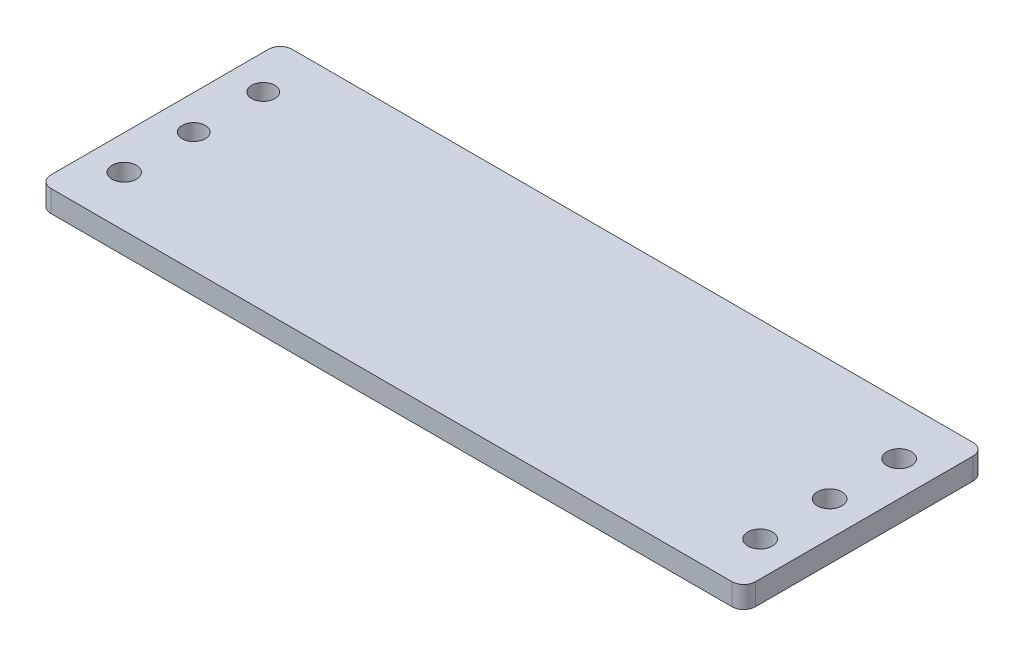
from build123d import *

# Parameters (mm, degrees)
SKETCH1_W           = 152.4
SKETCH1_H           = 52.832
BOSS_EXTRUDE1_DEPTH = 4.7625
SKETCH2_R           = 2.69
CUT_EXTRUDE1_DEPTH  = 81.789395729
SKETCH5_R           = 2.667
SKETCH5_R_2         = 2.54
CUT_EXTRUDE2_DEPTH  = 81.789395729
SKETCH6_W           = 52.832
SKETCH6_H           = 4.7625
BOSS_EXTRUDE2_DEPTH = 2
FILLET1_R           = 2.54


with BuildPart() as part:
    # Sketch1 → Boss-Extrude1 (new body)
    with BuildSketch(Plane(origin=(0, 0, 0), x_dir=(1, 0, 0), z_dir=(0, 1, 0))):
        Rectangle(SKETCH1_W, SKETCH1_H)
    extrude(amount=BOSS_EXTRUDE1_DEPTH)

    # Sketch2 → Cut-Extrude1 (cut, through all)
    with BuildSketch(Plane(origin=(0, 4.7625, 0), x_dir=(1, 0, 0), z_dir=(0, 1, 0))):
        with Locations(Location((68.607011479, -15.24, 0), (0, 0, 270))):
            Circle(SKETCH2_R)
        with Locations(Location((68.607011479, 0, 0), (0, 0, 270))):
            Circle(SKETCH2_R)
        with Locations(Location((68.607011479, 15.24, 0), (0, 0, 270))):
            Circle(SKETCH2_R)
    extrude(amount=-CUT_EXTRUDE1_DEPTH, mode=Mode.SUBTRACT)

    # Sketch5 → Cut-Extrude2 (cut, through all)
    with BuildSketch(Plane.XZ):
        with Locations(Location((-70.677366471, 15.3162, 0), (0, 0, 270))):
            Circle(SKETCH5_R)
        with Locations(Location((-70.677366471, 0.0762, 0), (0, 0, 270))):
            Circle(SKETCH5_R_2)
        with Locations(Location((-70.677366471, -15.1638, 0), (0, 0, 270))):
            Circle(SKETCH5_R_2)
    extrude(amount=-CUT_EXTRUDE2_DEPTH, mode=Mode.SUBTRACT)

    # Sketch6 → Boss-Extrude2 (add)
    with BuildSketch(Plane.ZY.offset(76.2)):
        with Locations((0, 2.38125)):
            Rectangle(SKETCH6_W, SKETCH6_H)
    extrude(amount=BOSS_EXTRUDE2_DEPTH)

    # Fillet1
    fillet1_edges = [part.edges().sort_by_distance(p)[0] for p in [
        (-78.2, 2.38125, 26.416),
        (-78.2, 2.38125, -26.416),
        (76.2, 2.38125, 26.416),
        (76.2, 2.38125, -26.416),
    ]]
    fillet(fillet1_edges, radius=FILLET1_R)


solid = part.part
